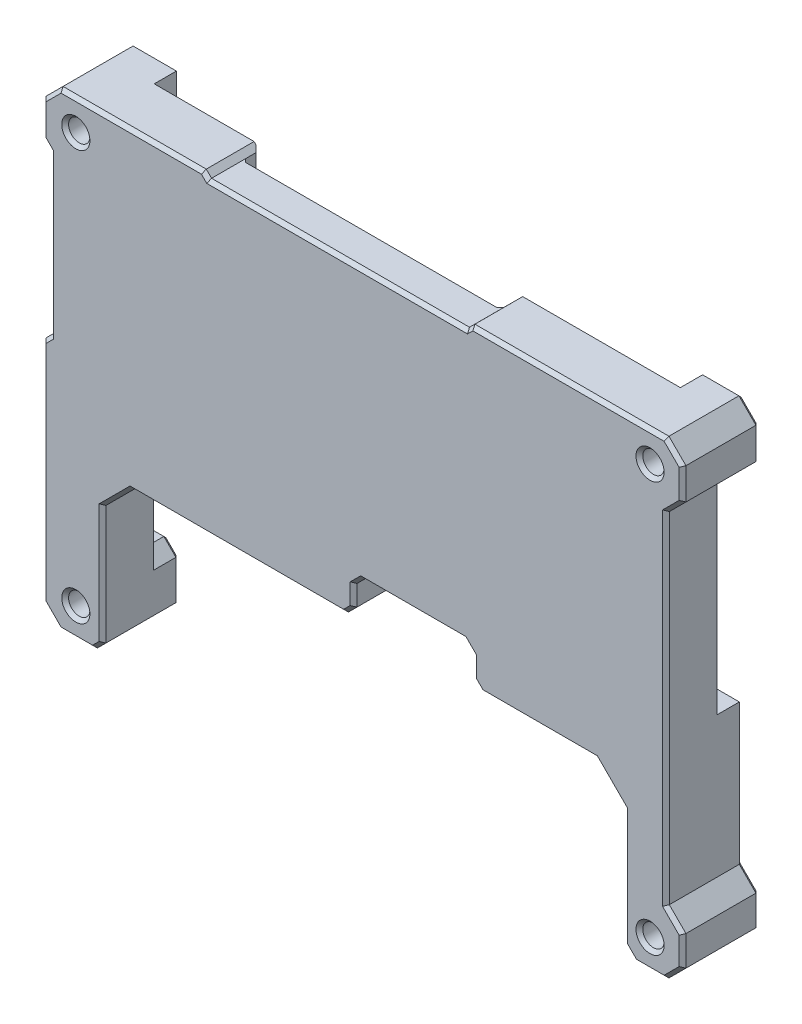
from build123d import *

# Parameters (mm, degrees)
SKETCH_1_W           = 85
SKETCH_1_H           = 65
EXTRUDE_1_DEPTH      = 10
CUT_EXTRUDE_1_REACH  = 109.471
SKETCH_2_R           = 1.25
CUT_EXTRUDE_2_REACH  = 109.471
SKETCH_3_W           = 85
SKETCH_3_H           = 65
CUT_EXTRUDE_4_REACH  = 102.464
CUT_EXTRUDE_7_DEPTH  = 6
CUT_EXTRUDE_8_DEPTH  = 6
CUT_EXTRUDE_11_DEPTH = 4
SKETCH_8_W           = 8
SKETCH_8_H           = 5
CUT_EXTRUDE_12_DEPTH = 1
SKETCH_10_W          = 5.4
SKETCH_10_H          = 6
SKETCH_10_W_2        = 4
EXTRUDE_2_DEPTH      = 2.040000001
SKETCH_11_W          = 4.2
SKETCH_11_H          = 5
EXTRUDE_3_DEPTH      = 1.300114616
SKETCH_12_W          = 12
SKETCH_12_H          = 6
EXTRUDE_4_DEPTH      = 2.040000001
SKETCH_13_W          = 3.114456334
SKETCH_13_H          = 4.982674998
EXTRUDE_5_DEPTH      = 2
SKETCH_15_W          = 14
SKETCH_15_H          = 4.4
CUT_EXTRUDE_13_DEPTH = 6
CHAMFER_1_SIZE       = 1
CHAMFER_2_SIZE       = 0.6
CHAMFER_5_SIZE       = 0.6
CUT_EXTRUDE_15_DEPTH = 4
CUT_EXTRUDE_16_DEPTH = 4
CHAMFER_6_SIZE       = 0.4
CHAMFER_8_SIZE       = 0.4
CHAMFER_9_SIZE       = 0.4
SKETCH_19_W          = 9.4
SKETCH_19_H          = 8.4
CUT_EXTRUDE_17_DEPTH = 2.4
CHAMFER_12_SIZE      = 0.4
CHAMFER_15_SIZE      = 0.4
SKETCH_20_R          = 1.25
CUT_EXTRUDE_18_DEPTH = 1
CHAMFER_16_SIZE      = 0.4
SKETCH_21_W          = 3.114456334
SKETCH_21_H          = 4.982674998
SKETCH_21_W_2        = 4.2
SKETCH_21_H_2        = 5
EXTRUDE_6_DEPTH      = 1.699885384
CHAMFER_17_SIZE      = 0.4
SKETCH_22_W          = 8
SKETCH_22_H          = 5
CUT_EXTRUDE_19_DEPTH = 1
CHAMFER_18_SIZE      = 0.4


with BuildPart() as part:
    # 草图1 → 凸台-拉伸1 (new body)
    with BuildSketch(Plane.XY):
        with Locations((42.5, 32.5)):
            Rectangle(SKETCH_1_W, SKETCH_1_H)
    extrude(amount=EXTRUDE_1_DEPTH)

    # 草图2 → 切除-拉伸1 (cut, up to next)
    with BuildSketch(Plane(origin=(0, 0, 0), x_dir=(-1, 0, 0), z_dir=(0, 0, -1)), mode=Mode.PRIVATE) as cut_extrude_1_sk1:
        with Locations((-76.166921514, 56.442524765)):
            Circle(SKETCH_2_R)
    cut_extrude_1_tool1 = extrude(cut_extrude_1_sk1.sketch, amount=-CUT_EXTRUDE_1_REACH, mode=Mode.PRIVATE) & part.part
    # 草图2 → 切除-拉伸1 (cut, up to next)
    with BuildSketch(Plane(origin=(0, 0, 0), x_dir=(-1, 0, 0), z_dir=(0, 0, -1)), mode=Mode.PRIVATE) as cut_extrude_1_sk2:
        with Locations((-8.888803658, 56.442524765)):
            Circle(SKETCH_2_R)
    cut_extrude_1_tool2 = extrude(cut_extrude_1_sk2.sketch, amount=-CUT_EXTRUDE_1_REACH, mode=Mode.PRIVATE) & part.part
    # 草图2 → 切除-拉伸1 (cut, up to next)
    with BuildSketch(Plane(origin=(0, 0, 0), x_dir=(-1, 0, 0), z_dir=(0, 0, -1)), mode=Mode.PRIVATE) as cut_extrude_1_sk3:
        with Locations((-76.166921514, 8.41508509)):
            Circle(SKETCH_2_R)
    cut_extrude_1_tool3 = extrude(cut_extrude_1_sk3.sketch, amount=-CUT_EXTRUDE_1_REACH, mode=Mode.PRIVATE) & part.part
    # 草图2 → 切除-拉伸1 (cut, up to next)
    with BuildSketch(Plane(origin=(0, 0, 0), x_dir=(-1, 0, 0), z_dir=(0, 0, -1)), mode=Mode.PRIVATE) as cut_extrude_1_sk4:
        with Locations((-8.888803658, 8.41508509)):
            Circle(SKETCH_2_R)
    cut_extrude_1_tool4 = extrude(cut_extrude_1_sk4.sketch, amount=-CUT_EXTRUDE_1_REACH, mode=Mode.PRIVATE) & part.part
    add(cut_extrude_1_tool1.solids().sort_by_distance((76.166922, 56.442525, 0))[0], mode=Mode.SUBTRACT)
    add(cut_extrude_1_tool2.solids().sort_by_distance((8.888804, 56.442525, 0))[0], mode=Mode.SUBTRACT)
    add(cut_extrude_1_tool3.solids().sort_by_distance((76.166922, 8.415085, 0))[0], mode=Mode.SUBTRACT)
    add(cut_extrude_1_tool4.solids().sort_by_distance((8.888804, 8.415085, 0))[0], mode=Mode.SUBTRACT)

    # 草图3 → 切除-拉伸2 (cut, up to next)
    with BuildSketch(Plane(origin=(0, 0, 0), x_dir=(-1, 0, 0), z_dir=(0, 0, -1)), mode=Mode.PRIVATE) as cut_extrude_2_sk1:
        with Locations((-42.5, 32.5)):
            Rectangle(SKETCH_3_W, SKETCH_3_H)
        Polygon((-5, 33.462892894), (-5.871324699, 34.334217592), (-5.87504445, 53.137061214), (-5, 54.017366187), (-5, 57.982143592), (-6.992565577, 59.974709169), (-23.773560915, 59.974709169), (-24.394872914, 59.353397171), (-54.61482093, 59.349677419), (-55.245113202, 59.974709169), (-77.982184232, 59.974709169), (-79.974749809, 57.982143592), (-79.97474981, 54.295829484), (-78.032030648, 52.353110322), (-78.028310897, 12.45999492), (-79.97474981, 10.508295484), (-79.97474981, 6.992565577), (-77.982184232, 5), (-74.414239441, 5), (-73.152434681, 6.26180476), (-60.043505207, 6.265524511), (-58.772720173, 5), (-32.926479725, 5), (-31.743585303, 6.182894422), (-17.461559563, 6.186614173), (-16.269684867, 5), (-6.992565577, 5), (-5, 6.992565577), align=None, mode=Mode.SUBTRACT)
    cut_extrude_2_tool1 = extrude(cut_extrude_2_sk1.sketch, amount=-CUT_EXTRUDE_2_REACH, mode=Mode.PRIVATE) & part.part
    add(cut_extrude_2_tool1.solids().sort_by_distance((42.5, 63.929953, 0))[0], mode=Mode.SUBTRACT)

    # 草图4 → 切除-拉伸4 (cut, up to next)
    with BuildSketch(Plane(origin=(0, 0, 0), x_dir=(-1, 0, 0), z_dir=(0, 0, -1)), mode=Mode.PRIVATE) as cut_extrude_4_sk1:
        Polygon((-73.152434681, 6.26180476), (-73.152434681, 20.032317315), (-69.831576581, 23.353175415), (-46.787984184, 23.353175415), (-15.403761553, 23.353175415), (-12.014024846, 19.963438707), (-12.014024846, 6.188032983), (-12.014024846, 0.193960815), (-73.152434681, 0.193960815), align=None)
    cut_extrude_4_tool1 = extrude(cut_extrude_4_sk1.sketch, amount=-CUT_EXTRUDE_4_REACH, mode=Mode.PRIVATE) & part.part
    add(cut_extrude_4_tool1.solids().sort_by_distance((42.587983, 11.689717, 0))[0], mode=Mode.SUBTRACT)

    # 草图5 → 切除-拉伸7 (cut)
    with BuildSketch(Plane(origin=(0, 0, 0), x_dir=(-1, 0, 0), z_dir=(0, 0, -1))):
        Polygon((-24.394872914, 59.353397171), (-24.394872914, 53.906418167), (-25.526104495, 52.774908066), (-53.482640788, 52.774908066), (-54.614150889, 53.906139647), (-54.61482093, 59.349677419), align=None)
    extrude(amount=-CUT_EXTRUDE_7_DEPTH, mode=Mode.SUBTRACT)

    # 草图6 → 切除-拉伸8 (cut)
    with BuildSketch(Plane(origin=(0, 0, 0), x_dir=(-1, 0, 0), z_dir=(0, 0, -1))):
        Polygon((-5.871324699, 34.334217592), (-11.671324699, 34.334217592), (-11.671324699, 50.334217592), (-5.874489966, 50.334217592), (-5.873484235, 45.250384759), align=None)
    extrude(amount=-CUT_EXTRUDE_8_DEPTH, mode=Mode.SUBTRACT)

    # 草图7 → 切除-拉伸11 (cut)
    with BuildSketch(Plane(origin=(0, 0, 0), x_dir=(-1, 0, 0), z_dir=(0, 0, -1))):
        Polygon((-74.432117646, 51.26230094), (-76.432117646, 51.26230094), (-78.031928938, 51.26230094), (-78.029847328, 28.93771831), (-75.029847328, 28.93771831), (-75.029847328, 13.93771831), (-73.152434681, 12.060305663), (-73.152434681, 20.032317315), (-69.831576581, 23.353175415), (-15.403761553, 23.353175415), (-12.014024846, 19.963438707), (-12.014024846, 10.599811284), (-10.599811284, 12.014024847), (-6.599811284, 12.014024847), (-5, 12.014024847), (-5, 33.462892894), (-5.871324699, 34.334217592), (-11.671324699, 34.334217592), (-11.671324699, 50.334217592), (-5.874489966, 50.334217592), (-5.87504445, 53.137061214), (-9.87504445, 53.137061214), (-12.071959353, 55.333976117), (-12.071959353, 58.333976117), (-23.061659554, 58.333976117), (-23.732127818, 57.663342778), (-24.394872914, 57.663261201), (-24.394872914, 53.906418167), (-25.526104495, 52.774908066), (-53.482640788, 52.774908066), (-54.614150889, 53.906139647), (-54.61482093, 59.349677419), (-55.245113202, 59.974709169), (-71.319520701, 59.974709169), (-71.319520701, 58.374897885), (-71.319520701, 54.374897885), align=None)
    extrude(amount=-CUT_EXTRUDE_11_DEPTH, mode=Mode.SUBTRACT)

    # 草图8 → 切除-拉伸12 (cut)
    with BuildSketch(Plane(origin=(0, 0, 4), x_dir=(-1, 0, 0), z_dir=(0, 0, -1))):
        with Locations((-69.348077333, 43.45871309)):
            Rectangle(SKETCH_8_W, SKETCH_8_H)
    extrude(amount=-CUT_EXTRUDE_12_DEPTH, mode=Mode.SUBTRACT)

    # 草图10 → 凸台-拉伸2 (add)
    with BuildSketch(Plane(origin=(0, 0, 4), x_dir=(-1, 0, 0), z_dir=(0, 0, -1))):
        with Locations((-44.246532103, 31.889800214)):
            Rectangle(SKETCH_10_W, SKETCH_10_H)
        with Locations((-39.546532103, 31.889800214)):
            Rectangle(SKETCH_10_W_2, SKETCH_10_H)
        with Locations((-34.846532103, 31.889800214)):
            Rectangle(SKETCH_10_W, SKETCH_10_H)
    extrude(amount=EXTRUDE_2_DEPTH)

    # 草图11 → 凸台-拉伸3 (add)
    with BuildSketch(Plane(origin=(0, 0, 4), x_dir=(-1, 0, 0), z_dir=(0, 0, -1))):
        with Locations((-38.731800654, 41.192864876)):
            Rectangle(SKETCH_11_W, SKETCH_11_H)
    extrude(amount=EXTRUDE_3_DEPTH)

    # 草图12 → 凸台-拉伸4 (add)
    with BuildSketch(Plane(origin=(0, 0, 4), x_dir=(-1, 0, 0), z_dir=(0, 0, -1))):
        with Locations((-24.610605003, 27.685920752)):
            Rectangle(SKETCH_12_W, SKETCH_12_H)
        Polygon((-30.610605003, 30.685920752), (-24.610605003, 30.685920752), (-32.146532103, 34.889800214), (-32.146532103, 28.889800214), (-30.610605003, 27.685920752), align=None)
    extrude(amount=EXTRUDE_4_DEPTH)

    # 草图13 → 凸台-拉伸5 (add)
    with BuildSketch(Plane(origin=(0, 0, 4), x_dir=(-1, 0, 0), z_dir=(0, 0, -1))):
        with Locations((-61.333013133, 38.127509711)):
            Rectangle(SKETCH_13_W, SKETCH_13_H)
    extrude(amount=EXTRUDE_5_DEPTH)

    # 草图15 → 切除-拉伸13 (cut)
    with BuildSketch(Plane.XY.offset(10)):
        with Locations((48.428848604, 25.553175415)):
            Rectangle(SKETCH_15_W, SKETCH_15_H)
    extrude(amount=-CUT_EXTRUDE_13_DEPTH, mode=Mode.SUBTRACT)

    # 倒角1
    chamfer_1_edges = [part.edges().sort_by_distance(p)[0] for p in [
        (12.014024846, 5, 5),
        (55.428848604, 23.353175415, 7),
        (55.428848604, 27.753175415, 7),
        (41.428848604, 27.753175415, 7),
        (41.428848604, 23.353175415, 7),
    ]]
    chamfer(chamfer_1_edges, length=CHAMFER_1_SIZE)

    # 倒角2
    chamfer_2_edges = [part.edges().sort_by_distance(p)[0] for p in [
        (62.8902413, 38.127509711, 4),
        (61.333013133, 35.636172212, 4),
        (59.775784966, 38.127509711, 4),
        (61.333013133, 40.61884721, 4),
    ]]
    chamfer(chamfer_2_edges, length=CHAMFER_2_SIZE)

    # 倒角5
    chamfer_5_edges = [part.edges().sort_by_distance(p)[0] for p in [
        (38.731800654, 43.692864876, 4),
        (36.631800654, 41.192864876, 4),
        (38.731800654, 38.692864876, 4),
        (40.831800654, 41.192864876, 4),
    ]]
    chamfer(chamfer_5_edges, length=CHAMFER_5_SIZE)

    # 草图17 → 切除-拉伸15 (cut)
    with BuildSketch(Plane(origin=(0, 0, 0), x_dir=(-1, 0, 0), z_dir=(0, 0, -1))):
        Polygon((-23.061659554, 58.333976117), (-12.071959353, 58.333976117), (-12.071959353, 59.974709169), (-23.773560915, 59.974709169), (-24.394872914, 59.353397171), (-24.394872914, 57.663261201), (-23.732127818, 57.663342778), align=None)
    extrude(amount=-CUT_EXTRUDE_15_DEPTH, mode=Mode.SUBTRACT)

    # 草图18 → 切除-拉伸16 (cut)
    with BuildSketch(Plane(origin=(0, 0, 0), x_dir=(-1, 0, 0), z_dir=(0, 0, -1))):
        Polygon((-71.319520701, 59.974709169), (-73.719520701, 59.974709169), (-73.719520701, 54.050166597), (-75.416576976, 52.353110322), (-78.032030648, 52.353110322), (-78.031928938, 51.26230094), (-74.432117646, 51.26230094), (-71.319520701, 54.374897885), align=None)
    extrude(amount=-CUT_EXTRUDE_16_DEPTH, mode=Mode.SUBTRACT)

    # 倒角6
    chamfer_6_edges = [part.edges().sort_by_distance(p)[0] for p in [
        (73.152434681, 13.147061037, 10),
        (71.492005631, 21.692746365, 10),
        (63.130212592, 23.353175415, 10),
        (13.7088932, 21.658307061, 10),
        (12.014024846, 12.981719354, 10),
        (10.138803658, 56.442524765, 10),
        (77.416921514, 8.41508509, 10),
        (10.138803658, 8.41508509, 10),
        (77.416921514, 56.442524765, 10),
        (48.428848604, 27.753175415, 10),
        (55.428848604, 25.553175415, 10),
        (27.916305079, 23.353175415, 10),
        (41.428848604, 25.553175415, 10),
        (55.928848604, 23.853175415, 10),
        (40.928848604, 23.853175415, 10),
        (11.514024846, 5.5, 10),
        (41.928848604, 27.253175415, 10),
        (54.928848604, 27.253175415, 10),
        (5.873184574, 43.735639403, 10),
        (5.435662349, 33.898555243, 10),
        (5, 20.227729235, 10),
        (5.996282789, 5.996282789, 10),
        (9.003295212, 5, 10),
        (73.783337061, 5.63090238, 10),
        (76.198211836, 5, 10),
        (78.978467021, 5.996282789, 10),
        (79.97474981, 8.750430531, 10),
        (79.001530353, 11.484145202, 10),
        (78.030170772, 32.406552621, 10),
        (79.003390229, 53.324469903, 10),
        (79.974749809, 56.138986538, 10),
        (78.978467021, 58.978426381, 10),
        (66.613648717, 59.974709169, 10),
        (54.929967066, 59.662193294, 10),
        (39.504846922, 59.351537295, 10),
        (24.084216914, 59.66405317, 10),
        (15.383063246, 59.974709169, 10),
        (5.996282789, 58.978426381, 10),
        (5, 55.99975489, 10),
        (5.437522225, 53.577213701, 10),
    ]]
    chamfer(chamfer_6_edges, length=CHAMFER_6_SIZE)

    # 倒角8
    chamfer_8_edges = [part.edges().sort_by_distance(p)[0] for p in [
        (8.771324699, 34.334217592, 6),
        (11.671324699, 42.334217592, 6),
        (11.671324699, 34.334217592, 5),
        (8.772907332, 50.334217592, 6),
        (11.671324699, 50.334217592, 5),
        (8.772907332, 50.334217592, 4),
        (11.671324699, 42.334217592, 4),
        (8.771324699, 34.334217592, 4),
    ]]
    chamfer(chamfer_8_edges, length=CHAMFER_8_SIZE)

    # 倒角9
    chamfer_9_edges = [part.edges().sort_by_distance(p)[0] for p in [
        (24.394872914, 56.629907669, 6),
        (24.960488704, 53.340663116, 6),
        (39.504372641, 52.774908066, 6),
        (54.048395838, 53.340523857, 6),
        (54.614485909, 56.627908533, 6),
        (54.614485909, 56.627908533, 4),
        (54.048395838, 53.340523857, 4),
        (39.504372641, 52.774908066, 4),
        (24.960488704, 53.340663116, 4),
        (24.394872914, 56.629907669, 4),
    ]]
    chamfer(chamfer_9_edges, length=CHAMFER_9_SIZE)

    # 草图19 → 切除-拉伸17 (cut)
    with BuildSketch(Plane(origin=(0, 0, 4), x_dir=(-1, 0, 0), z_dir=(0, 0, -1))):
        with Locations((-62.931576581, 27.553175415)):
            Rectangle(SKETCH_19_W, SKETCH_19_H)
    extrude(amount=-CUT_EXTRUDE_17_DEPTH, mode=Mode.SUBTRACT)

    # 倒角12
    chamfer_12_edges = [part.edges().sort_by_distance(p)[0] for p in [
        (67.631576581, 27.553175415, 6.4),
        (67.631576581, 23.353175415, 5.2),
        (62.931576581, 31.753175415, 6.4),
        (67.631576581, 31.753175415, 5.2),
        (58.231576581, 27.553175415, 6.4),
        (58.231576581, 31.753175415, 5.2),
        (62.931576581, 23.353175415, 6.4),
        (58.231576581, 23.353175415, 5.2),
        (67.631576581, 27.553175415, 4),
        (58.231576581, 27.553175415, 4),
        (62.931576581, 31.753175415, 4),
    ]]
    chamfer(chamfer_12_edges, length=CHAMFER_12_SIZE)

    # 倒角15
    chamfer_15_edges = [part.edges().sort_by_distance(p)[0] for p in [
        (39.546532103, 34.889800214, 4),
        (46.946532103, 31.889800214, 4),
        (39.546532103, 28.889800214, 4),
        (28.378568553, 32.787860483, 4),
        (31.378568553, 28.287860483, 4),
        (30.610605003, 26.185920752, 4),
        (24.610605003, 24.685920752, 4),
        (21.610605003, 30.685920752, 4),
        (18.610605003, 27.685920752, 4),
    ]]
    chamfer(chamfer_15_edges, length=CHAMFER_15_SIZE)

    # 草图20 → 切除-拉伸18 (cut)
    # profile 1 of 4: a face of its own
    with BuildSketch(Plane(origin=(0, 0, 0), x_dir=(-1, 0, 0), z_dir=(0, 0, -1))):
        Polygon((-6.992565577, 59.974709169), (-12.071959353, 59.974709169), (-12.071959353, 55.333976117), (-9.87504445, 53.137061214), (-5.87504445, 53.137061214), (-5, 54.017366187), (-5, 57.982143592), align=None)
        with Locations((-8.888803658, 56.442524765)):
            Circle(SKETCH_20_R, mode=Mode.SUBTRACT)
    # profile 2 of 4: a face of its own
    with BuildSketch(Plane(origin=(0, 0, 0), x_dir=(-1, 0, 0), z_dir=(0, 0, -1))):
        Polygon((-73.719520701, 54.050166597), (-73.719520701, 59.974709169), (-77.982184232, 59.974709169), (-79.974749809, 57.982143592), (-79.97474981, 54.295829484), (-78.032030648, 52.353110322), (-75.416576976, 52.353110322), align=None)
        with Locations((-76.166921514, 56.442524765)):
            Circle(SKETCH_20_R, mode=Mode.SUBTRACT)
    # profile 3 of 4: a face of its own
    with BuildSketch(Plane(origin=(0, 0, 0), x_dir=(-1, 0, 0), z_dir=(0, 0, -1))):
        Polygon((-73.152434681, 6.26180476), (-73.152434681, 12.060305663), (-75.029847328, 13.93771831), (-75.029847328, 28.93771831), (-78.029847328, 28.93771831), (-78.028310897, 12.45999492), (-79.97474981, 10.508295484), (-79.97474981, 6.992565577), (-77.982184232, 5), (-74.414239441, 5), align=None)
        with Locations((-76.166921514, 8.41508509)):
            Circle(SKETCH_20_R, mode=Mode.SUBTRACT)
    # profile 4 of 4: a face of its own
    with BuildSketch(Plane(origin=(0, 0, 0), x_dir=(-1, 0, 0), z_dir=(0, 0, -1))):
        Polygon((-12.014024846, 10.599811286), (-12.014024846, 6), (-11.014024846, 5), (-6.992565577, 5), (-5, 6.992565577), (-5, 12.014024847), (-10.599811284, 12.014024847), align=None)
        with Locations((-8.888803658, 8.41508509)):
            Circle(SKETCH_20_R, mode=Mode.SUBTRACT)
    extrude(amount=-CUT_EXTRUDE_18_DEPTH, mode=Mode.SUBTRACT)

    # 倒角16
    chamfer_16_edges = [part.edges().sort_by_distance(p)[0] for p in [
        (10.138803658, 56.442524765, 1),
        (5, 55.99975489, 1),
        (5.437522225, 53.577213701, 1),
        (7.87504445, 53.137061214, 1),
        (10.973501901, 54.235518665, 1),
        (12.071959353, 57.654342643, 1),
        (9.532262465, 59.974709169, 1),
        (5.996282789, 58.978426381, 1),
        (11.306918065, 11.306918066, 1),
        (7.799905642, 12.014024847, 1),
        (5, 9.503295212, 1),
        (5.996282789, 5.996282789, 1),
        (9.003295212, 5, 1),
        (11.514024846, 5.5, 1),
        (12.014024846, 8.299905643, 1),
        (10.138803658, 8.41508509, 1),
        (77.416921514, 8.41508509, 1),
        (76.198211836, 5, 1),
        (78.978467021, 5.996282789, 1),
        (79.97474981, 8.750430531, 1),
        (79.001530353, 11.484145202, 1),
        (78.029079112, 20.698856615, 1),
        (76.529847328, 28.93771831, 1),
        (75.029847328, 21.43771831, 1),
        (74.091141004, 12.999011987, 1),
        (73.152434681, 9.161055212, 1),
        (73.783337061, 5.63090238, 1),
        (77.416921514, 56.442524765, 1),
        (76.724303812, 52.353110322, 1),
        (79.003390229, 53.324469903, 1),
        (79.974749809, 56.138986538, 1),
        (78.978467021, 58.978426381, 1),
        (75.850852466, 59.974709169, 1),
        (73.719520701, 57.012437883, 1),
        (74.568048838, 53.20163846, 1),
    ]]
    chamfer(chamfer_16_edges, length=CHAMFER_16_SIZE)

    # 草图21 → 凸台-拉伸6 (add)
    with BuildSketch(Plane(origin=(0, 0, 1), x_dir=(-1, 0, 0), z_dir=(0, 0, -1))):
        with Locations((-61.333013133, 38.127509711)):
            Rectangle(SKETCH_21_W, SKETCH_21_H)
        Polygon((-46.946532103, 28.889800214), (-32.146532103, 28.889800214), (-30.610605003, 27.685920752), (-30.610605003, 24.685920752), (-18.610605003, 24.685920752), (-18.610605003, 30.685920752), (-24.610605003, 30.685920752), (-32.146532103, 34.889800214), (-46.946532103, 34.889800214), align=None)
        with Locations((-38.731800654, 41.192864876)):
            Rectangle(SKETCH_21_W_2, SKETCH_21_H_2)
    extrude(amount=-EXTRUDE_6_DEPTH)

    # 倒角17
    chamfer_17_edges = [part.edges().sort_by_distance(p)[0] for p in [
        (61.333013133, 40.61884721, 1),
        (62.8902413, 38.127509711, 1),
        (61.333013133, 35.636172212, 1),
        (59.775784966, 38.127509711, 1),
        (46.946532103, 31.889800214, 1),
        (39.546532103, 28.889800214, 1),
        (31.378568553, 28.287860483, 1),
        (30.610605003, 26.185920752, 1),
        (24.610605003, 24.685920752, 1),
        (18.610605003, 27.685920752, 1),
        (21.610605003, 30.685920752, 1),
        (28.378568553, 32.787860483, 1),
        (39.546532103, 34.889800214, 1),
        (40.831800654, 41.192864876, 1),
        (38.731800654, 38.692864876, 1),
        (36.631800654, 41.192864876, 1),
        (38.731800654, 43.692864876, 1),
    ]]
    chamfer(chamfer_17_edges, length=CHAMFER_17_SIZE)

    # 草图22 → 切除-拉伸19 (cut)
    with BuildSketch(Plane(origin=(0, 0, 5), x_dir=(-1, 0, 0), z_dir=(0, 0, -1))):
        with Locations((-69.348077333, 43.45871309)):
            Rectangle(SKETCH_22_W, SKETCH_22_H)
    extrude(amount=-CUT_EXTRUDE_19_DEPTH, mode=Mode.SUBTRACT)

    # 倒角18
    chamfer_18_edges = [part.edges().sort_by_distance(p)[0] for p in [
        (73.348077333, 43.45871309, 6),
        (69.348077333, 40.95871309, 6),
        (65.348077333, 43.45871309, 6),
        (69.348077333, 45.95871309, 6),
        (73.348077333, 40.95871309, 5),
        (73.348077333, 45.95871309, 5),
        (65.348077333, 45.95871309, 5),
        (65.348077333, 40.95871309, 5),
        (73.348077333, 43.45871309, 4),
        (69.348077333, 40.95871309, 4),
        (65.348077333, 43.45871309, 4),
        (69.348077333, 45.95871309, 4),
    ]]
    chamfer(chamfer_18_edges, length=CHAMFER_18_SIZE)


solid = part.part
